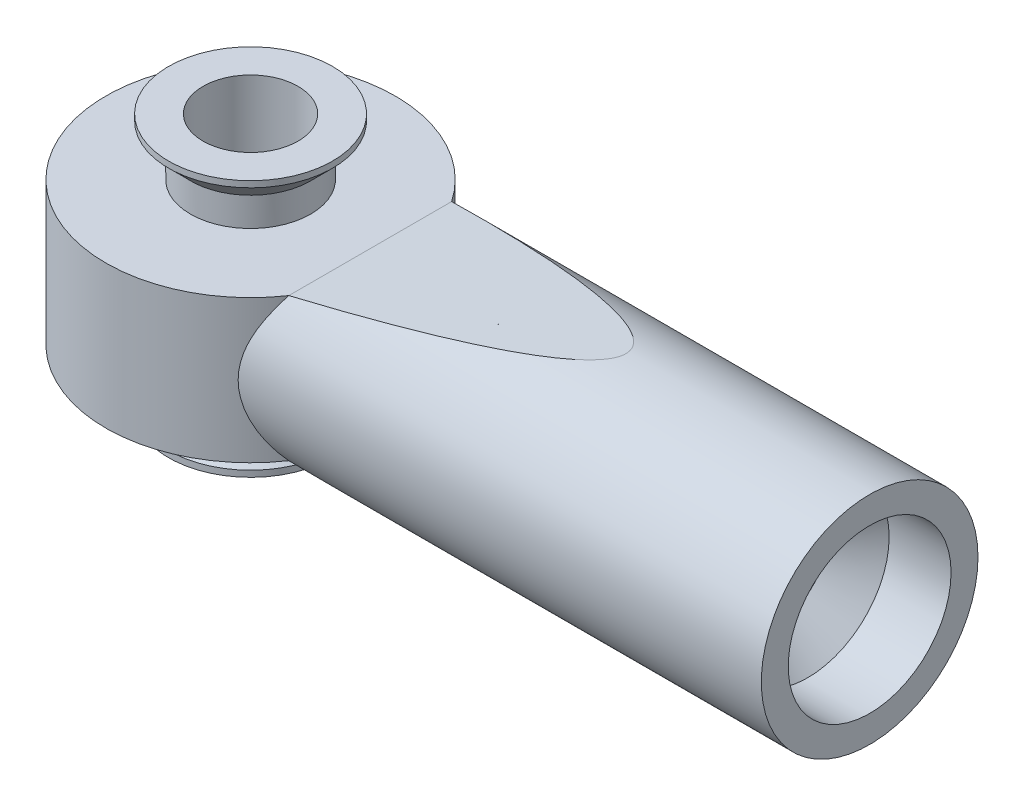
from build123d import *

# Parameters (mm, degrees)
SKETCH1_R           = 3.5
SKETCH1_R_2         = 2.63
SKETCH1_R_3         = 1.6
BOSS_EXTRUDE1_DEPTH = 17
SKETCH2_R           = 4.675
BOSS_EXTRUDE2_DEPTH = 2.31
CUT_EXTRUDE1_DEPTH  = 18.975139222
BOSS_EXTRUDE3_START = 17
SKETCH1_3_R         = 3.5
SKETCH1_3_R_2       = 2.63
BOSS_EXTRUDE3_DEPTH = 3
SKETCH5_R           = 1.535
CUT_EXTRUDE2_DEPTH  = 23.152779282
CHAMFER1_SIZE       = 1


with BuildPart() as part:
    # Sketch1 → Boss-Extrude1 (new body)
    # profile 1 of 2: a face of its own
    with BuildSketch(Plane(origin=(0, 0, 0), x_dir=(0, 0, -1), z_dir=(1, 0, 0))):
        Circle(SKETCH1_R)
        Circle(SKETCH1_R_2, mode=Mode.SUBTRACT)
    # profile 2 of 2: a face of its own
    with BuildSketch(Plane(origin=(0, 0, 0), x_dir=(0, 0, -1), z_dir=(1, 0, 0))):
        Circle(SKETCH1_R_2)
        Circle(SKETCH1_R_3, mode=Mode.SUBTRACT)
    extrude(amount=BOSS_EXTRUDE1_DEPTH)

    # Sketch2 → Boss-Extrude2 (add, symmetric)
    with BuildSketch(Plane(origin=(0, 0, 0), x_dir=(1, 0, 0), z_dir=(0, 1, 0))):
        Circle(SKETCH2_R)
    extrude(amount=BOSS_EXTRUDE2_DEPTH, both=True)

    # Sketch3 → Cut-Extrude1 (cut, symmetric)
    with BuildSketch(Plane.XY):
        Polygon((66.444481418, 11.326116973), (12.125, 3.5), (3.865452755, 2.31), (-4.675, 2.31), (-59.55536232, 2.31), (-67.389432633, 111.790792909), (58.610411105, 120.806909882), align=None)
    cut_extrude1 = extrude(amount=CUT_EXTRUDE1_DEPTH, both=True, mode=Mode.SUBTRACT)

    # Mirror1: Cut-Extrude1 across plane
    add(cut_extrude1.mirror(Plane.ZX), mode=Mode.SUBTRACT)

    # Sketch1<3> → Boss-Extrude3 (add)
    with BuildSketch(Plane(origin=(0, 0, 0), x_dir=(0, 0, -1), z_dir=(1, 0, 0)).offset(BOSS_EXTRUDE3_START)):
        with Locations(Location((0, 0, 0), (0, 0, 221.299872792))):
            Circle(SKETCH1_3_R)
        Circle(SKETCH1_3_R_2, mode=Mode.SUBTRACT)
    extrude(amount=BOSS_EXTRUDE3_DEPTH)

    # Sketch4 → Revolve1 (revolve)
    with BuildSketch(Plane.XY, mode=Mode.PRIVATE) as revolve1_sk:
        Polygon((0, 4.15), (2.65, 4.15), (2.65, 3.95), (1.94, 3.24), (1.94, 2.31), (0, 2.31), align=None)
    revolve1 = revolve(revolve1_sk.sketch.rotate(Axis((0, 2.31, 0), (0, 1, 0)), 90), axis=Axis((0, 2.31, 0), (0, 1, 0)))

    # Mirror2: Revolve1 across plane
    add(revolve1.mirror(Plane.ZX))

    # Sketch5 → Cut-Extrude2 (cut, through all)
    with BuildSketch(Plane(origin=(0, 4.15, 0), x_dir=(1, 0, 0), z_dir=(0, 1, 0))):
        with Locations(Location((0, 0, 0), (0, 0, 270))):
            Circle(SKETCH5_R)
    extrude(amount=-CUT_EXTRUDE2_DEPTH, mode=Mode.SUBTRACT)

    # Chamfer1
    chamfer1_edges = [part.edges().sort_by_distance(p)[0] for p in [
        (17, 0, 2.63),
    ]]
    chamfer(chamfer1_edges, length=CHAMFER1_SIZE)


solid = part.part
